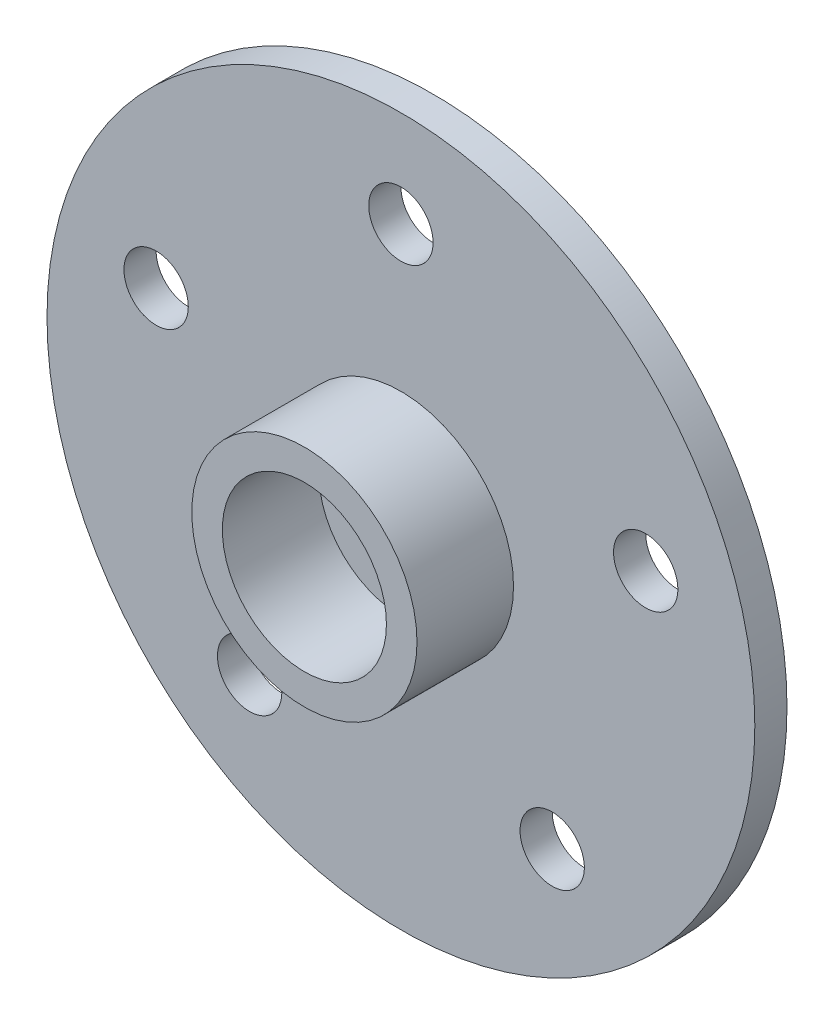
from build123d import *

# Parameters (mm, degrees)
SKETCH_1_R      = 22
SKETCH_1_R_2    = 3.15
SKETCH_1_R_3    = 2
EXTRUDE_1_DEPTH = 2
SKETCH_2_R      = 7
SKETCH_2_R_2    = 5.1
EXTRUDE_3_DEPTH = 6


with BuildPart() as part:
    # 草图1 → 凸台-拉伸1 (new body)
    with BuildSketch(Plane.XY):
        Circle(SKETCH_1_R)
        Circle(SKETCH_1_R_2, mode=Mode.SUBTRACT)
        with Locations((0, 16)):
            Circle(SKETCH_1_R_3, mode=Mode.SUBTRACT)
        with Locations((15.216904261, 4.94427191)):
            Circle(SKETCH_1_R_3, mode=Mode.SUBTRACT)
        with Locations((9.404564037, -12.94427191)):
            Circle(SKETCH_1_R_3, mode=Mode.SUBTRACT)
        with Locations((-9.404564037, -12.94427191)):
            Circle(SKETCH_1_R_3, mode=Mode.SUBTRACT)
        with Locations((-15.216904261, 4.94427191)):
            Circle(SKETCH_1_R_3, mode=Mode.SUBTRACT)
    extrude(amount=EXTRUDE_1_DEPTH)

    # 草图2 → 凸台-拉伸3 (add)
    with BuildSketch(Plane.XY.offset(2)):
        Circle(SKETCH_2_R)
        Circle(SKETCH_2_R_2, mode=Mode.SUBTRACT)
    extrude(amount=EXTRUDE_3_DEPTH)


solid = part.part
